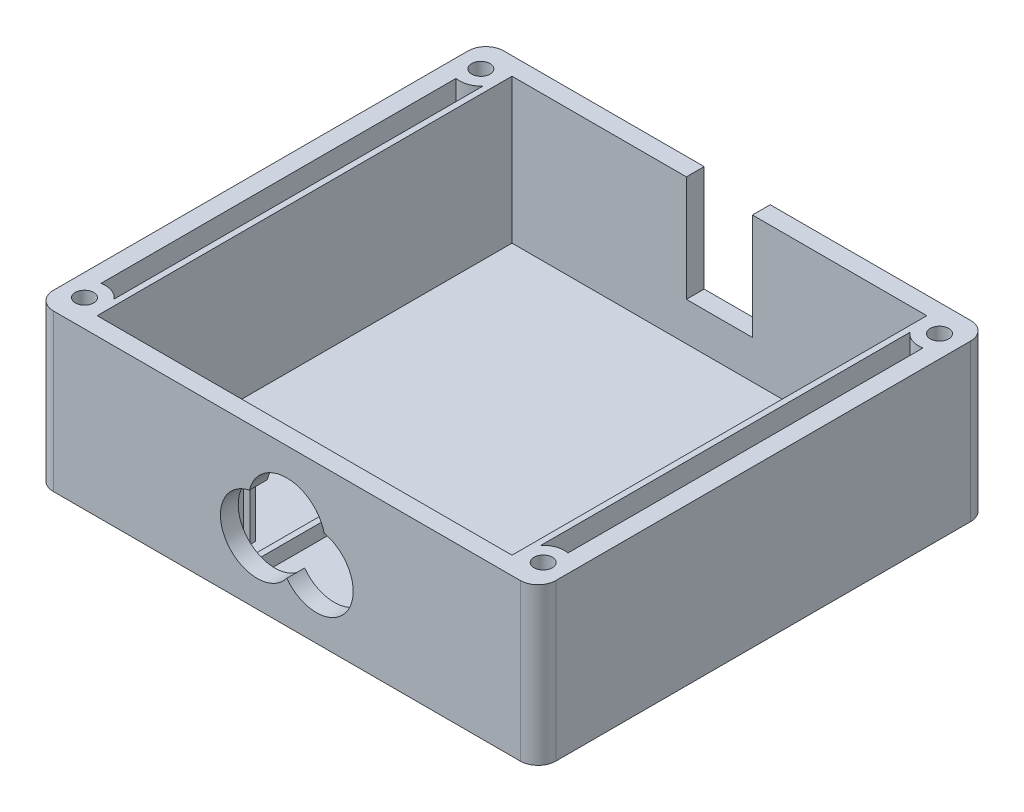
from build123d import *

# Parameters (mm, degrees)
SKETCH2_W            = 70
SKETCH2_H            = 70
BOSS_EXTRUDE1_DEPTH  = 2
BOSS_EXTRUDE2_DEPTH  = 18
SKETCH3_3_W          = 1
SKETCH3_3_H          = 15
BOSS_EXTRUDE3_DEPTH  = 2.5
SKETCH4_W            = 72
SKETCH4_H            = 76
SKETCH4_W_2          = 70
SKETCH4_H_2          = 70
BOSS_EXTRUDE4_DEPTH  = 26.4
SKETCH12_R           = 1.55
BOSS_EXTRUDE10_DEPTH = 26.4
BOSS_EXTRUDE11_DEPTH = 5
SKETCH1_R            = 1.18
SKETCH1_R_2          = 1.6
CUT_EXTRUDE1_DEPTH   = 25
FILLET1_R            = 3
CUT_EXTRUDE4_DEPTH   = 2.7
CUT_EXTRUDE5_DEPTH   = 10


with BuildPart() as part:
    # Sketch2 → Boss-Extrude1 (new body)
    with BuildSketch(Plane(origin=(0, 0, 0), x_dir=(1, 0, 0), z_dir=(0, 1, 0))):
        Rectangle(SKETCH2_W, SKETCH2_H)
    extrude(amount=BOSS_EXTRUDE1_DEPTH)

    # Sketch3 → Boss-Extrude2 (add)
    with BuildSketch(Plane(origin=(0, 2, 0), x_dir=(1, 0, 0), z_dir=(0, 1, 0))):
        Polygon((13.05, -31.2), (14.15, -31.2), (14.15, -35), (15.15, -35), (15.15, -30.2), (13.05, -30.2), align=None)
        Polygon((-15.15, -35), (-14.15, -35), (-14.15, -31.2), (-13.05, -31.2), (-13.05, -30.2), (-15.15, -30.2), align=None)
    extrude(amount=BOSS_EXTRUDE2_DEPTH)

    # Sketch3<3> → Boss-Extrude3 (add)
    with BuildSketch(Plane(origin=(0, 2, 0), x_dir=(1, 0, 0), z_dir=(0, 1, 0))):
        with Locations((-8.3, -27.5)):
            Rectangle(SKETCH3_3_W, SKETCH3_3_H)
        with Locations((8.3, -27.5)):
            Rectangle(SKETCH3_3_W, SKETCH3_3_H)
    extrude(amount=BOSS_EXTRUDE3_DEPTH)

    # Sketch4 → Boss-Extrude4 (add)
    with BuildSketch(Plane(origin=(0, 0, 0), x_dir=(1, 0, 0), z_dir=(0, 1, 0))):
        Rectangle(SKETCH4_W, SKETCH4_H)
        Rectangle(SKETCH4_W_2, SKETCH4_H_2, mode=Mode.SUBTRACT)
    extrude(amount=BOSS_EXTRUDE4_DEPTH)

    # Sketch12 → Boss-Extrude10 (add)
    # profile 1 of 2: a face of its own
    with BuildSketch(Plane(origin=(0, 0, 0), x_dir=(1, 0, 0), z_dir=(0, 1, 0))):
        with BuildLine():
            Line((36, -38), (42.4, -38))
            Line((42.4, -38), (42.4, 38))
            Line((42.4, 38), (36, 38))
            Line((36, 38), (36, 35.746040388))
            ThreePointArc((36, 35.746040388), (35.639428233, 31.642432378), (39.4, 29.960852562))
            Line((39.4, 29.960852562), (39.4, -29.960852562))
            ThreePointArc((39.4, -29.960852562), (35.639428233, -31.642432378), (36, -35.746040388))
            Line((36, -35.746040388), (36, -38))
        make_face()
        with Locations(Location((38.7, -33.441154273, 0), (0, 0, 270))):
            Circle(SKETCH12_R, mode=Mode.SUBTRACT)
        with Locations(Location((38.7, 33.441154273, 0), (0, 0, 270))):
            Circle(SKETCH12_R, mode=Mode.SUBTRACT)
    # profile 2 of 2: a face of its own
    with BuildSketch(Plane(origin=(0, 0, 0), x_dir=(1, 0, 0), z_dir=(0, 1, 0))):
        with BuildLine():
            Line((-36, 38), (-36, 35.746040388))
            ThreePointArc((-36, 35.746040388), (-35.639428233, 31.642432378), (-39.4, 29.960852562))
            Line((-39.4, 29.960852562), (-39.4, -29.960852562))
            ThreePointArc((-39.4, -29.960852562), (-35.639428233, -31.642432378), (-36, -35.746040388))
            Line((-36, -35.746040388), (-36, -38))
            Line((-36, -38), (-42.4, -38))
            Line((-42.4, -38), (-42.4, 38))
            Line((-42.4, 38), (-36, 38))
        make_face()
        with Locations(Location((-38.7, 33.441154273, 0), (0, 0, 90))):
            Circle(SKETCH12_R, mode=Mode.SUBTRACT)
        with Locations(Location((-38.7, -33.441154273, 0), (0, 0, 90))):
            Circle(SKETCH12_R, mode=Mode.SUBTRACT)
    extrude(amount=BOSS_EXTRUDE10_DEPTH)

    # Sketch13 → Boss-Extrude11 (add)
    with BuildSketch(Plane(origin=(0, 0, 0), x_dir=(1, 0, 0), z_dir=(0, 1, 0))):
        with BuildLine():
            Line((39.4, 29.960852562), (39.4, -29.960852562))
            ThreePointArc((39.4, -29.960852562), (37.540086013, -30.085994136), (36, -31.136268159))
            Line((36, -31.136268159), (36, 31.136268159))
            ThreePointArc((36, 31.136268159), (37.540086013, 30.085994136), (39.4, 29.960852562))
        make_face()
        with BuildLine():
            Line((-39.4, -29.960852562), (-39.4, 29.960852562))
            ThreePointArc((-39.4, 29.960852562), (-37.540086013, 30.085994136), (-36, 31.136268159))
            Line((-36, 31.136268159), (-36, -31.136268159))
            ThreePointArc((-36, -31.136268159), (-37.540086013, -30.085994136), (-39.4, -29.960852562))
        make_face()
    extrude(amount=BOSS_EXTRUDE11_DEPTH)

    # Sketch1 → Cut-Extrude1 (cut)
    # profile 1 of 5: a face of its own
    with BuildSketch(Plane.XY.offset(38)):
        with BuildLine():
            ThreePointArc((6.310018649, 16.760020721), (0, 21.7), (-6.310018649, 16.760020721))
            ThreePointArc((-6.310018649, 16.760020721), (-10.201264735, 7.325560023), (0, 7.033939444))
            ThreePointArc((0, 7.033939444), (10.201264735, 7.325560023), (6.310018649, 16.760020721))
        make_face()
        with BuildLine():
            ThreePointArc((4.487784147, 14.868649052), (0, 19.7), (-4.487784147, 14.868649052))
            ThreePointArc((-4.487784147, 14.868649052), (-8.121835414, 7.890348127), (-0.800613643, 10.771792937))
            ThreePointArc((-0.800613643, 10.771792937), (0, 10.7), (0.800613643, 10.771792937))
            ThreePointArc((0.800613643, 10.771792937), (8.121835414, 7.890348127), (4.487784147, 14.868649052))
        make_face(mode=Mode.SUBTRACT)
    # profile 2 of 5: a face of its own
    with BuildSketch(Plane.XY.offset(38)):
        with BuildLine():
            ThreePointArc((0.800613643, 10.771792937), (8.121835414, 7.890348127), (4.487784147, 14.868649052))
            ThreePointArc((4.487784147, 14.868649052), (0, 19.7), (-4.487784147, 14.868649052))
            ThreePointArc((-4.487784147, 14.868649052), (-8.121835414, 7.890348127), (-0.800613643, 10.771792937))
            ThreePointArc((-0.800613643, 10.771792937), (0, 10.7), (0.800613643, 10.771792937))
        make_face()
        with Locations((-5, 10.7)):
            Circle(SKETCH1_R, mode=Mode.SUBTRACT)
        with Locations((5, 10.7)):
            Circle(SKETCH1_R, mode=Mode.SUBTRACT)
        with Locations((0, 15.2)):
            Circle(SKETCH1_R_2, mode=Mode.SUBTRACT)
    # profile 3 of 5: a face of its own
    with BuildSketch(Plane.XY.offset(38)):
        with Locations((0, 15.2)):
            Circle(SKETCH1_R_2)
    # profile 4 of 5: a face of its own
    with BuildSketch(Plane.XY.offset(38)):
        with Locations((5, 10.7)):
            Circle(SKETCH1_R)
    # profile 5 of 5: a face of its own
    with BuildSketch(Plane.XY.offset(38)):
        with Locations((-5, 10.7)):
            Circle(SKETCH1_R)
    extrude(amount=-CUT_EXTRUDE1_DEPTH, mode=Mode.SUBTRACT)

    # Fillet1
    fillet1_edges = [part.edges().sort_by_distance(p)[0] for p in [
        (42.4, 13.2, -38),
        (42.4, 13.2, 38),
        (-42.4, 13.2, 38),
        (-42.4, 13.2, -38),
    ]]
    fillet(fillet1_edges, radius=FILLET1_R)

    # Sketch14 → Cut-Extrude4 (cut)
    with BuildSketch(Plane.XZ):
        Polygon((-41.425, 31.86787479), (-38.7, 30.294595306), (-35.975, 31.86787479), (-35.975, 35.014433757), (-38.7, 36.58771324), (-41.425, 35.014433757), align=None)
        Polygon((41.425, 31.86787479), (41.425, 35.014433757), (38.7, 36.58771324), (35.975, 35.014433757), (35.975, 31.86787479), (38.7, 30.294595306), align=None)
        Polygon((41.425, -35.014433757), (41.425, -31.86787479), (38.7, -30.294595306), (35.975, -31.86787479), (35.975, -35.014433757), (38.7, -36.58771324), align=None)
        Polygon((-35.975, -35.014433757), (-35.975, -31.86787479), (-38.7, -30.294595306), (-41.425, -31.86787479), (-41.425, -35.014433757), (-38.7, -36.58771324), align=None)
    extrude(amount=-CUT_EXTRUDE4_DEPTH, mode=Mode.SUBTRACT)

    # Sketch15 → Cut-Extrude5 (cut)
    with BuildSketch(Plane(origin=(0, 0, -38), x_dir=(-1, 0, 0), z_dir=(0, 0, -1))):
        Polygon((-5.575, 14), (-5.575, 26.4), (5.575, 26.4), (5.575, 14), (5.575, 8.5), (-5.575, 8.5), align=None)
    extrude(amount=-CUT_EXTRUDE5_DEPTH, mode=Mode.SUBTRACT)


solid = part.part
